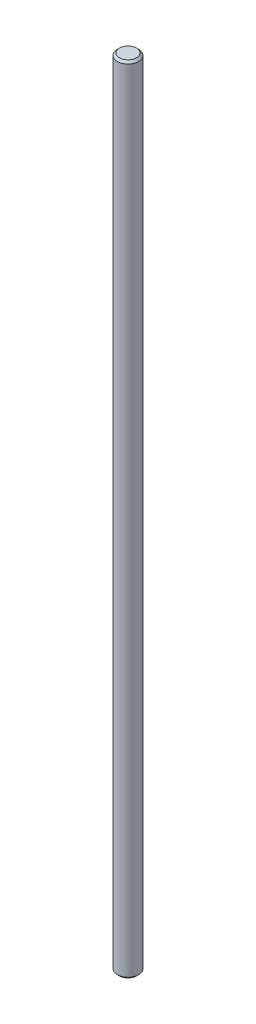
from build123d import *

# Parameters (mm, degrees)
SKETCH1_R           = 5
BOSS_EXTRUDE1_DEPTH = 375
CHAMFER1_SIZE       = 1


with BuildPart() as part:
    # Sketch1 → Boss-Extrude1 (new body)
    with BuildSketch(Plane(origin=(0, 0, 0), x_dir=(1, 0, 0), z_dir=(0, 1, 0))):
        with Locations(Location((0, 0, 0), (0, 0, 270))):
            Circle(SKETCH1_R)
    extrude(amount=BOSS_EXTRUDE1_DEPTH)

    # Chamfer1
    chamfer1_edges = [part.edges().sort_by_distance(p)[0] for p in [
        (0, 0, -5),
        (0, 375, -5),
    ]]
    chamfer(chamfer1_edges, length=CHAMFER1_SIZE)


solid = part.part
